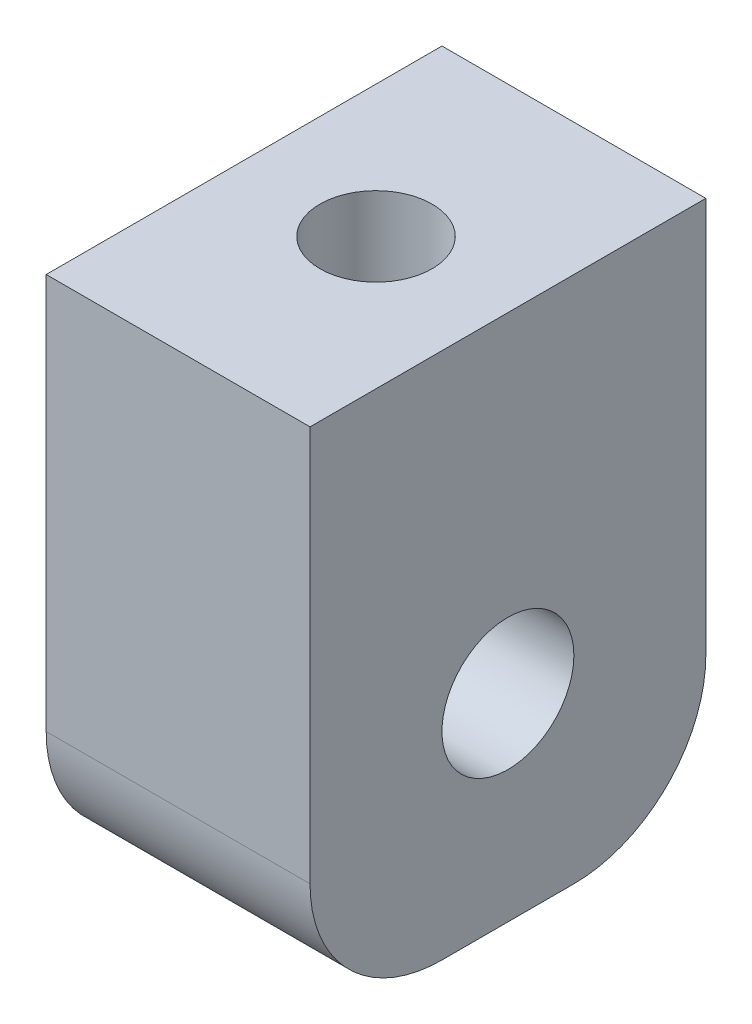
from build123d import *

# Parameters (mm, degrees)
SKETCH1_W               = 20
SKETCH1_H               = 30
BOSS_EXTRUDE1_DEPTH     = 40
SKETCH2_R               = 4.25
CUT_EXTRUDE1_DEPTH      = 15
CUT_EXTRUDE2_DEPTH      = 44.874821937
CUT_EXTRUDE2_DEPTH_BACK = 44.874821937
SKETCH11_R              = 5
FILLET1_R               = 10


with BuildPart() as part:
    # Sketch1 → Boss-Extrude1 (new body)
    with BuildSketch(Plane(origin=(0, 0, 0), x_dir=(1, 0, 0), z_dir=(0, 1, 0))):
        Rectangle(SKETCH1_W, SKETCH1_H)
    extrude(amount=-BOSS_EXTRUDE1_DEPTH)

    # Sketch2 → Cut-Extrude1 (cut)
    with BuildSketch(Plane(origin=(0, 0, 0), x_dir=(1, 0, 0), z_dir=(0, 1, 0))):
        with Locations(Location((0, 0, 0), (0, 0, 270))):
            Circle(SKETCH2_R)
    extrude(amount=-CUT_EXTRUDE1_DEPTH, mode=Mode.SUBTRACT)

    # Sketch11 → Cut-Extrude2 (cut, two sides: drawn at the far end of the back side and taken through both)
    with BuildSketch(Plane(origin=(0, 0, 0), x_dir=(0, 0, -1), z_dir=(1, 0, 0)).offset(-CUT_EXTRUDE2_DEPTH_BACK)):
        with Locations((0, -25)):
            Circle(SKETCH11_R)
    extrude(amount=CUT_EXTRUDE2_DEPTH + CUT_EXTRUDE2_DEPTH_BACK, mode=Mode.SUBTRACT)

    # Fillet1
    fillet1_edges = [part.edges().sort_by_distance(p)[0] for p in [
        (0, -40, 15),
        (0, -40, -15),
    ]]
    fillet(fillet1_edges, radius=FILLET1_R)


solid = part.part
